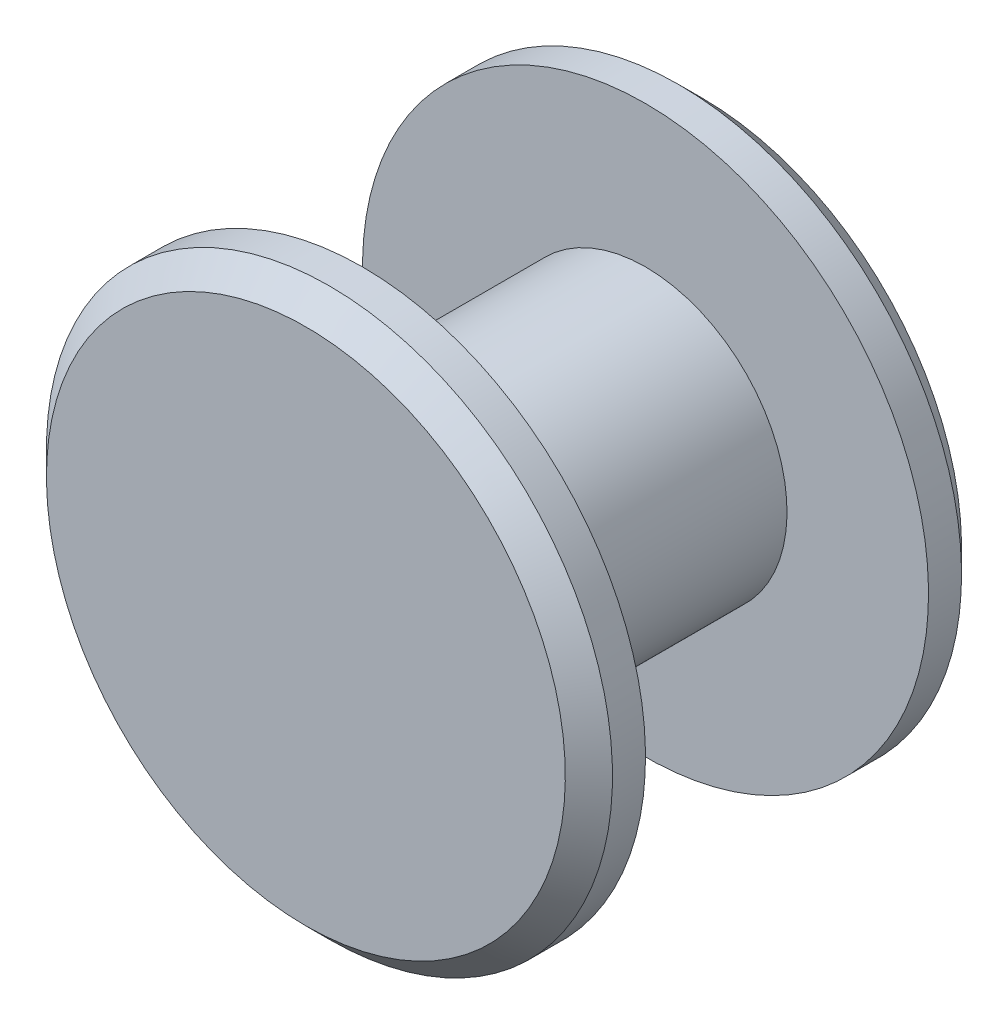
from build123d import *

# Parameters (mm, degrees)
CHAMFER1_SIZE = 0.25


with BuildPart() as part:
    # Sketch1 → Revolve1 (revolve)
    with BuildSketch(Plane(origin=(0, 0, 0), x_dir=(0, 0, -1), z_dir=(1, 0, 0))):
        Polygon((0, 0), (0, 3), (0.6, 3), (0.6, 1.5), (3.6, 1.5), (3.6, 3), (4.2, 3), (4.2, 0), align=None)
    revolve(axis=Axis((0, 0, 0), (0, 0, 1)))

    # Chamfer1
    chamfer1_edges = [part.edges().sort_by_distance(p)[0] for p in [
        (0, -3, -4.2),
        (0, -3, 0),
    ]]
    chamfer(chamfer1_edges, length=CHAMFER1_SIZE)


solid = part.part
